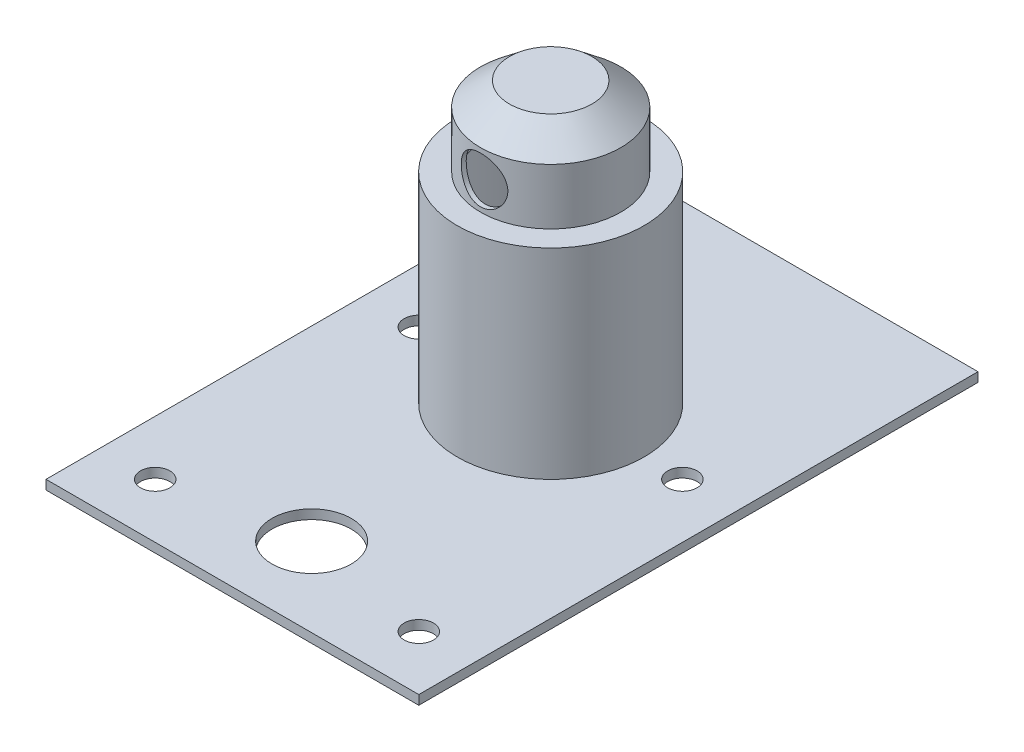
from build123d import *

# Parameters (mm, degrees)
SKETCH1_R               = 3.15
SKETCH1_R_2             = 8.5
BOSS_EXTRUDE1_DEPTH     = 2
CUT_EXTRUDE1_DEPTH      = 103.378146357
CUT_EXTRUDE1_DEPTH_BACK = 103.378146357
SKETCH3_R               = 5
SKETCH4_R               = 19.045268753
CUT_EXTRUDE2_DEPTH      = 145.904268766


with BuildPart() as part:
    # Sketch1 → Boss-Extrude1 (new body)
    with BuildSketch(Plane(origin=(0, 0, 0), x_dir=(1, 0, 0), z_dir=(0, 1, 0))):
        Polygon((-35.591494606, 84.19795391), (-35.591494606, 4.19795391), (44.408505394, 4.19795391), (44.408505394, 84.19795391), (44.408505394, 124.19795391), (-35.591494606, 124.19795391), align=None)
        with Locations(Location((-23.875765854, 72.482225157, 0), (0, 0, 270))):
            Circle(SKETCH1_R, mode=Mode.SUBTRACT)
        with Locations(Location((4.408505394, 21.19795391, 0), (0, 0, 270))):
            Circle(SKETCH1_R_2, mode=Mode.SUBTRACT)
        with Locations(Location((32.692776641, 72.482225157, 0), (0, 0, 270))):
            Circle(SKETCH1_R, mode=Mode.SUBTRACT)
        with Locations(Location((-23.875765854, 15.913682662, 0), (0, 0, 270))):
            Circle(SKETCH1_R, mode=Mode.SUBTRACT)
        with Locations(Location((32.692776641, 15.913682662, 0), (0, 0, 270))):
            Circle(SKETCH1_R, mode=Mode.SUBTRACT)
    extrude(amount=BOSS_EXTRUDE1_DEPTH)

    # Sketch4 → Cut-Extrude2 (cut, through all)
    with BuildSketch(Plane(origin=(0, 2, 0), x_dir=(1, 0, 0), z_dir=(0, 1, 0))):
        with Locations(Location((4.408505394, 72.5, 0), (0, 0, 180))):
            Circle(SKETCH4_R)
    extrude(amount=-CUT_EXTRUDE2_DEPTH, mode=Mode.SUBTRACT)


with BuildPart() as body_2:
    # Sketch2 → Revolve1 (revolve)
    with BuildSketch(Plane.XY.offset(-72.5), mode=Mode.PRIVATE) as revolve1_sk:
        Polygon((4.408505394, 62), (13.250142643, 62), (19.453774147, 57), (19.453774147, 45), (24.453774147, 45), (24.453774147, 2), (23.453774147, 2), (23.453774147, 44), (18.453774147, 44), (18.453774147, 56.521610812), (12.897318897, 61), (4.408505394, 61), align=None)
    revolve(revolve1_sk.sketch.rotate(Axis((4.408505394, 20.129467617, -72.5), (0, -1, 0)), 180), axis=Axis((4.408505394, 20.129467617, -72.5), (0, -1, 0)))

    # Sketch3 → Cut-Extrude1 (cut, two sides: drawn at the far end of the back side and taken through both)
    with BuildSketch(Plane.XY.offset(-72.5).offset(-CUT_EXTRUDE1_DEPTH_BACK)):
        with Locations((4.408505394, 51)):
            Circle(SKETCH3_R)
    extrude(amount=CUT_EXTRUDE1_DEPTH + CUT_EXTRUDE1_DEPTH_BACK, mode=Mode.SUBTRACT)


solid = Compound([part.part, body_2.part])
